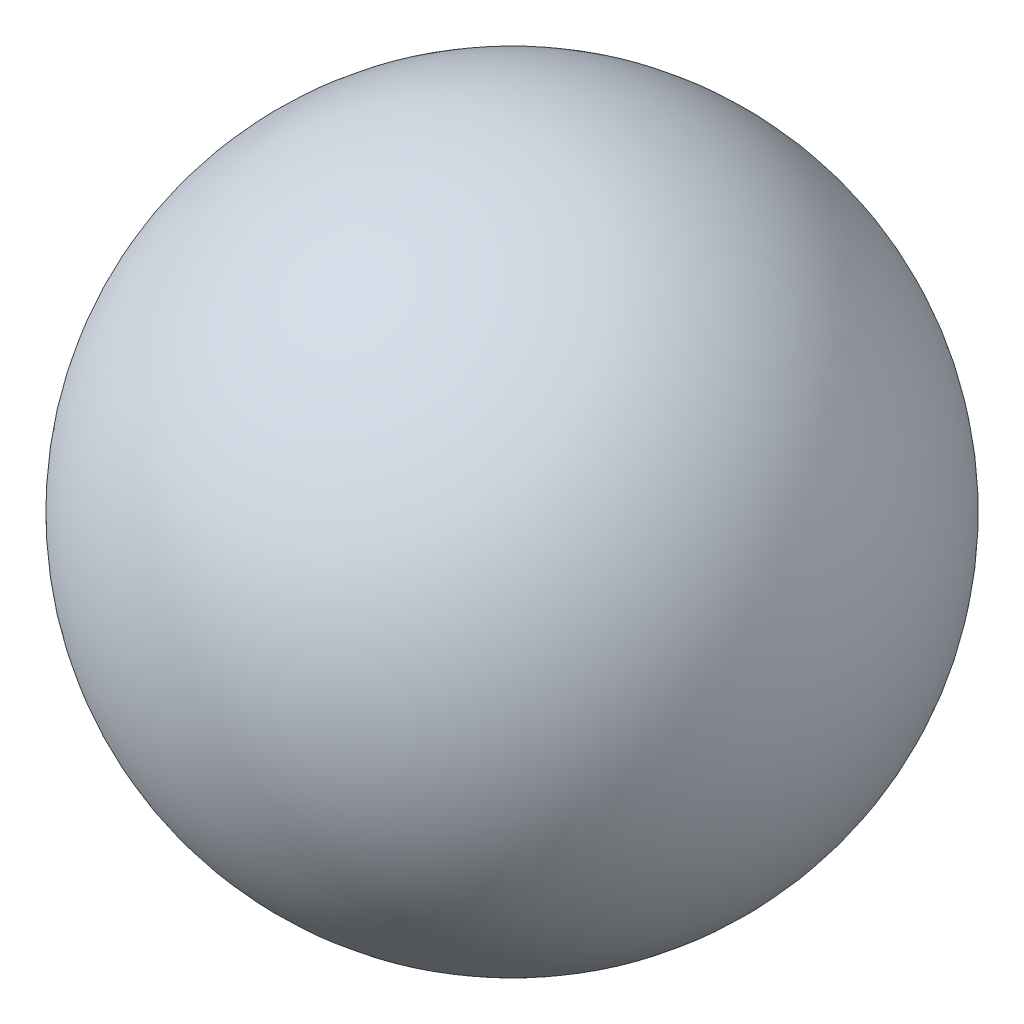
from build123d import *


with BuildPart() as part:
    # Esquisse1 → Révolution1 (revolve)
    with BuildSketch(Plane.XY):
        with BuildLine():
            Line((0, 8), (0, 0))
            ThreePointArc((0, 0), (4, 4), (0, 8))
        make_face()
    revolve(axis=Axis((0, 8, 0), (0, -1, 0)))


solid = part.part
